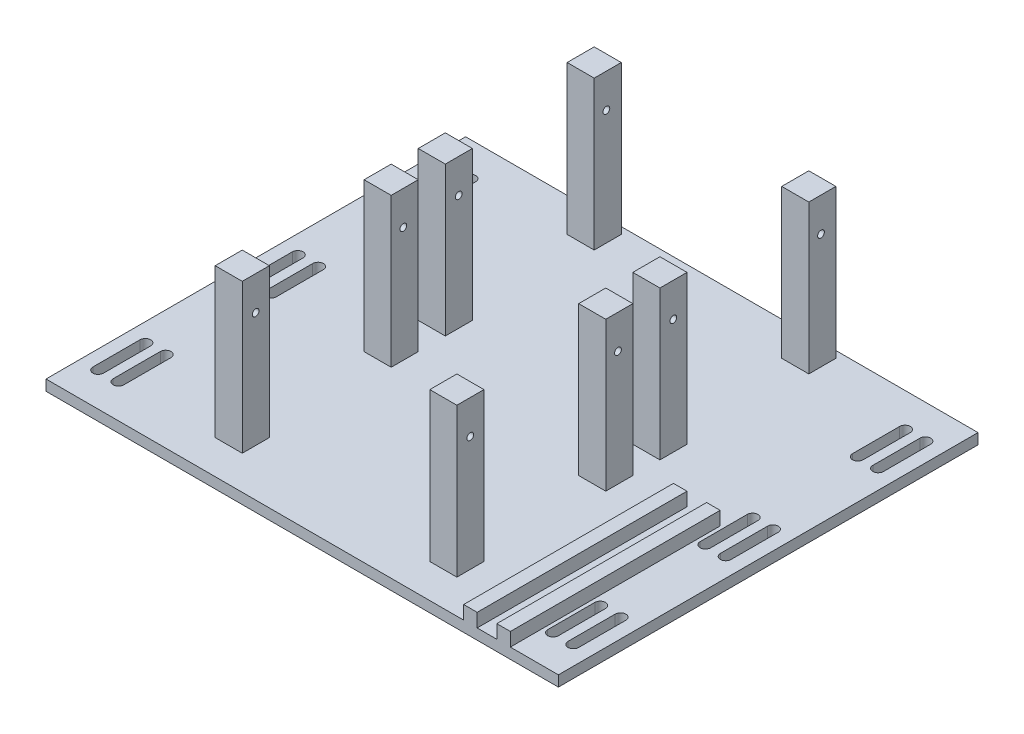
from build123d import *

# Parameters (mm, degrees)
SKETCH1_W                           = 96.1517
SKETCH1_H                           = 78.74
BASE_PLATE_DEPTH                    = 2
SKETCH2_W                           = 5.08
SKETCH2_H                           = 5.08
SERVO_SUPPORTS_DEPTH                = 27.94
SKETCH3_R                           = 0.635
SERVO_MOUNT_HOLES_DEPTH             = 12.7
STRAP_HOLES_REACH                   = 70.132
SERVO_MOUNT_SPACING_COUNT           = 2
SERVO_MOUNT_SPACING_PITCH           = 38.1
SERVO_MOUNT_SPACING_COPY_1_SKETCH_W = 5.08
SERVO_MOUNT_SPACING_COPY_1_SKETCH_H = 5.08
SERVO_MOUNT_SPACING_COPY_1_DEPTH    = 27.94
SERVO_MOUNT_SPACING_COPY_2_SKETCH_R = 0.635
SERVO_MOUNT_SPACING_COPY_2_DEPTH    = 12.7
SKETCH11_W                          = 2.54
SKETCH11_H                          = 39.37
RACK_RAILS_DEPTH                    = 2.54


with BuildPart() as part:
    # Sketch1 → Base Plate (new body)
    with BuildSketch(Plane(origin=(0, 0, 0), x_dir=(1, 0, 0), z_dir=(0, 1, 0))):
        Rectangle(SKETCH1_W, SKETCH1_H)
    extrude(amount=BASE_PLATE_DEPTH)

    # Sketch2 → Servo Supports (add)
    with BuildSketch(Plane(origin=(0, 2, 0), x_dir=(1, 0, 0), z_dir=(0, 1, 0))):
        with Locations((20.13585, -30.48)):
            Rectangle(SKETCH2_W, SKETCH2_H)
        with Locations((20.13585, -2.54)):
            Rectangle(SKETCH2_W, SKETCH2_H)
    servo_supports = extrude(amount=SERVO_SUPPORTS_DEPTH)

    # Sketch3 → Servo Mount Holes (cut)
    with BuildSketch(Plane(origin=(22.67585, 0, 0), x_dir=(0, 0, -1), z_dir=(1, 0, 0))):
        with Locations((-30.504257117, 23.59)):
            Circle(SKETCH3_R)
        with Locations((-2.792857117, 23.59)):
            Circle(SKETCH3_R)
    servo_mount_holes = extrude(amount=-SERVO_MOUNT_HOLES_DEPTH, mode=Mode.SUBTRACT)

    # Sketch4 → Strap Holes (cut, up to next)
    with BuildSketch(Plane(origin=(0, 2, 0), x_dir=(1, 0, 0), z_dir=(0, 1, 0)), mode=Mode.PRIVATE) as strap_holes_sk1:
        with BuildLine():
            Line((45.53585, -24.17), (45.53585, -33.02))
            ThreePointArc((45.53585, -33.02), (44.53585, -34.02), (43.53585, -33.02))
            Line((43.53585, -33.02), (43.53585, -24.17))
            ThreePointArc((43.53585, -24.17), (44.53585, -23.17), (45.53585, -24.17))
        make_face()
    strap_holes_tool1 = extrude(strap_holes_sk1.sketch, amount=-STRAP_HOLES_REACH, mode=Mode.PRIVATE) & part.part
    # Sketch4 → Strap Holes (cut, up to next)
    with BuildSketch(Plane(origin=(0, 2, 0), x_dir=(1, 0, 0), z_dir=(0, 1, 0)), mode=Mode.PRIVATE) as strap_holes_sk2:
        with BuildLine():
            Line((45.53585, 33.02), (45.53585, 24.17))
            ThreePointArc((45.53585, 24.17), (44.53585, 23.17), (43.53585, 24.17))
            Line((43.53585, 24.17), (43.53585, 33.02))
            ThreePointArc((43.53585, 33.02), (44.53585, 34.02), (45.53585, 33.02))
        make_face()
    strap_holes_tool2 = extrude(strap_holes_sk2.sketch, amount=-STRAP_HOLES_REACH, mode=Mode.PRIVATE) & part.part
    # Sketch4 → Strap Holes (cut, up to next)
    with BuildSketch(Plane(origin=(0, 2, 0), x_dir=(1, 0, 0), z_dir=(0, 1, 0)), mode=Mode.PRIVATE) as strap_holes_sk3:
        with BuildLine():
            Line((-43.63085, -24.17), (-43.63085, -33.02))
            ThreePointArc((-43.63085, -33.02), (-44.63085, -34.02), (-45.63085, -33.02))
            Line((-45.63085, -33.02), (-45.63085, -24.17))
            ThreePointArc((-45.63085, -24.17), (-44.63085, -23.17), (-43.63085, -24.17))
        make_face()
    strap_holes_tool3 = extrude(strap_holes_sk3.sketch, amount=-STRAP_HOLES_REACH, mode=Mode.PRIVATE) & part.part
    # Sketch4 → Strap Holes (cut, up to next)
    with BuildSketch(Plane(origin=(0, 2, 0), x_dir=(1, 0, 0), z_dir=(0, 1, 0)), mode=Mode.PRIVATE) as strap_holes_sk4:
        with BuildLine():
            Line((-43.63085, 33.02), (-43.63085, 24.17))
            ThreePointArc((-43.63085, 24.17), (-44.63085, 23.17), (-45.63085, 24.17))
            Line((-45.63085, 24.17), (-45.63085, 33.02))
            ThreePointArc((-45.63085, 33.02), (-44.63085, 34.02), (-43.63085, 33.02))
        make_face()
    strap_holes_tool4 = extrude(strap_holes_sk4.sketch, amount=-STRAP_HOLES_REACH, mode=Mode.PRIVATE) & part.part
    # Sketch4 → Strap Holes (cut, up to next)
    with BuildSketch(Plane(origin=(0, 2, 0), x_dir=(1, 0, 0), z_dir=(0, 1, 0)), mode=Mode.PRIVATE) as strap_holes_sk5:
        with BuildLine():
            Line((45.53585, 4.425), (45.53585, -4.425))
            ThreePointArc((45.53585, -4.425), (44.53585, -5.425), (43.53585, -4.425))
            Line((43.53585, -4.425), (43.53585, 4.425))
            ThreePointArc((43.53585, 4.425), (44.53585, 5.425), (45.53585, 4.425))
        make_face()
    strap_holes_tool5 = extrude(strap_holes_sk5.sketch, amount=-STRAP_HOLES_REACH, mode=Mode.PRIVATE) & part.part
    # Sketch4 → Strap Holes (cut, up to next)
    with BuildSketch(Plane(origin=(0, 2, 0), x_dir=(1, 0, 0), z_dir=(0, 1, 0)), mode=Mode.PRIVATE) as strap_holes_sk6:
        with BuildLine():
            Line((-43.63085, 4.425), (-43.63085, -4.425))
            ThreePointArc((-43.63085, -4.425), (-44.63085, -5.425), (-45.63085, -4.425))
            Line((-45.63085, -4.425), (-45.63085, 4.425))
            ThreePointArc((-45.63085, 4.425), (-44.63085, 5.425), (-43.63085, 4.425))
        make_face()
    strap_holes_tool6 = extrude(strap_holes_sk6.sketch, amount=-STRAP_HOLES_REACH, mode=Mode.PRIVATE) & part.part
    # Sketch4 → Strap Holes (cut, up to next)
    with BuildSketch(Plane(origin=(0, 2, 0), x_dir=(1, 0, 0), z_dir=(0, 1, 0)), mode=Mode.PRIVATE) as strap_holes_sk7:
        with BuildLine():
            Line((41.72585, -24.17), (41.72585, -33.02))
            ThreePointArc((41.72585, -33.02), (40.72585, -34.02), (39.72585, -33.02))
            Line((39.72585, -33.02), (39.72585, -24.17))
            ThreePointArc((39.72585, -24.17), (40.72585, -23.17), (41.72585, -24.17))
        make_face()
    strap_holes_tool7 = extrude(strap_holes_sk7.sketch, amount=-STRAP_HOLES_REACH, mode=Mode.PRIVATE) & part.part
    # Sketch4 → Strap Holes (cut, up to next)
    with BuildSketch(Plane(origin=(0, 2, 0), x_dir=(1, 0, 0), z_dir=(0, 1, 0)), mode=Mode.PRIVATE) as strap_holes_sk8:
        with BuildLine():
            Line((41.72585, 33.02), (41.72585, 24.17))
            ThreePointArc((41.72585, 24.17), (40.72585, 23.17), (39.72585, 24.17))
            Line((39.72585, 24.17), (39.72585, 33.02))
            ThreePointArc((39.72585, 33.02), (40.72585, 34.02), (41.72585, 33.02))
        make_face()
    strap_holes_tool8 = extrude(strap_holes_sk8.sketch, amount=-STRAP_HOLES_REACH, mode=Mode.PRIVATE) & part.part
    # Sketch4 → Strap Holes (cut, up to next)
    with BuildSketch(Plane(origin=(0, 2, 0), x_dir=(1, 0, 0), z_dir=(0, 1, 0)), mode=Mode.PRIVATE) as strap_holes_sk9:
        with BuildLine():
            Line((41.72585, 4.425), (41.72585, -4.425))
            ThreePointArc((41.72585, -4.425), (40.72585, -5.425), (39.72585, -4.425))
            Line((39.72585, -4.425), (39.72585, 4.425))
            ThreePointArc((39.72585, 4.425), (40.72585, 5.425), (41.72585, 4.425))
        make_face()
    strap_holes_tool9 = extrude(strap_holes_sk9.sketch, amount=-STRAP_HOLES_REACH, mode=Mode.PRIVATE) & part.part
    # Sketch4 → Strap Holes (cut, up to next)
    with BuildSketch(Plane(origin=(0, 2, 0), x_dir=(1, 0, 0), z_dir=(0, 1, 0)), mode=Mode.PRIVATE) as strap_holes_sk10:
        with BuildLine():
            Line((-39.82085, -24.17), (-39.82085, -33.02))
            ThreePointArc((-39.82085, -33.02), (-40.82085, -34.02), (-41.82085, -33.02))
            Line((-41.82085, -33.02), (-41.82085, -24.17))
            ThreePointArc((-41.82085, -24.17), (-40.82085, -23.17), (-39.82085, -24.17))
        make_face()
    strap_holes_tool10 = extrude(strap_holes_sk10.sketch, amount=-STRAP_HOLES_REACH, mode=Mode.PRIVATE) & part.part
    # Sketch4 → Strap Holes (cut, up to next)
    with BuildSketch(Plane(origin=(0, 2, 0), x_dir=(1, 0, 0), z_dir=(0, 1, 0)), mode=Mode.PRIVATE) as strap_holes_sk11:
        with BuildLine():
            Line((-39.82085, 33.02), (-39.82085, 24.17))
            ThreePointArc((-39.82085, 24.17), (-40.82085, 23.17), (-41.82085, 24.17))
            Line((-41.82085, 24.17), (-41.82085, 33.02))
            ThreePointArc((-41.82085, 33.02), (-40.82085, 34.02), (-39.82085, 33.02))
        make_face()
    strap_holes_tool11 = extrude(strap_holes_sk11.sketch, amount=-STRAP_HOLES_REACH, mode=Mode.PRIVATE) & part.part
    # Sketch4 → Strap Holes (cut, up to next)
    with BuildSketch(Plane(origin=(0, 2, 0), x_dir=(1, 0, 0), z_dir=(0, 1, 0)), mode=Mode.PRIVATE) as strap_holes_sk12:
        with BuildLine():
            Line((-39.82085, 4.425), (-39.82085, -4.425))
            ThreePointArc((-39.82085, -4.425), (-40.82085, -5.425), (-41.82085, -4.425))
            Line((-41.82085, -4.425), (-41.82085, 4.425))
            ThreePointArc((-41.82085, 4.425), (-40.82085, 5.425), (-39.82085, 4.425))
        make_face()
    strap_holes_tool12 = extrude(strap_holes_sk12.sketch, amount=-STRAP_HOLES_REACH, mode=Mode.PRIVATE) & part.part
    add(strap_holes_tool1.solids().sort_by_distance((44.53585, 2, 28.595))[0], mode=Mode.SUBTRACT)
    add(strap_holes_tool2.solids().sort_by_distance((44.53585, 2, -28.595))[0], mode=Mode.SUBTRACT)
    add(strap_holes_tool3.solids().sort_by_distance((-44.63085, 2, 28.595))[0], mode=Mode.SUBTRACT)
    add(strap_holes_tool4.solids().sort_by_distance((-44.63085, 2, -28.595))[0], mode=Mode.SUBTRACT)
    add(strap_holes_tool5.solids().sort_by_distance((44.53585, 2, 0))[0], mode=Mode.SUBTRACT)
    add(strap_holes_tool6.solids().sort_by_distance((-44.63085, 2, 0))[0], mode=Mode.SUBTRACT)
    add(strap_holes_tool7.solids().sort_by_distance((40.72585, 2, 28.595))[0], mode=Mode.SUBTRACT)
    add(strap_holes_tool8.solids().sort_by_distance((40.72585, 2, -28.595))[0], mode=Mode.SUBTRACT)
    add(strap_holes_tool9.solids().sort_by_distance((40.72585, 2, 0))[0], mode=Mode.SUBTRACT)
    add(strap_holes_tool10.solids().sort_by_distance((-40.82085, 2, 28.595))[0], mode=Mode.SUBTRACT)
    add(strap_holes_tool11.solids().sort_by_distance((-40.82085, 2, -28.595))[0], mode=Mode.SUBTRACT)
    add(strap_holes_tool12.solids().sort_by_distance((-40.82085, 2, 0))[0], mode=Mode.SUBTRACT)

    # Servo Mount Mirror: Servo Supports, Servo Mount Holes across plane
    add(servo_supports.mirror(Plane(origin=(0, 0, 0), x_dir=(0, 0, 1), z_dir=(1, 0, 0))))
    add(servo_mount_holes.mirror(Plane(origin=(0, 0, 0), x_dir=(0, 0, 1), z_dir=(1, 0, 0))), mode=Mode.SUBTRACT)

    # Servo Mount Spacing: Servo Supports, Servo Mount Holes ×2
    with Locations(*[(0, 0, -i * SERVO_MOUNT_SPACING_PITCH) for i in range(1, SERVO_MOUNT_SPACING_COUNT)]):
        add(servo_supports)
        add(servo_mount_holes, mode=Mode.SUBTRACT)

    # Servo Mount Spacing copy 1 sketch → Servo Mount Spacing copy 1 (add)
    with BuildSketch(Plane(origin=(0, 2, -38.1), x_dir=(-1, 0, 0), z_dir=(0, 1, 0))):
        with Locations((20.13585, 30.48)):
            Rectangle(SERVO_MOUNT_SPACING_COPY_1_SKETCH_W, SERVO_MOUNT_SPACING_COPY_1_SKETCH_H)
        with Locations((20.13585, 2.54)):
            Rectangle(SERVO_MOUNT_SPACING_COPY_1_SKETCH_W, SERVO_MOUNT_SPACING_COPY_1_SKETCH_H)
    extrude(amount=SERVO_MOUNT_SPACING_COPY_1_DEPTH)

    # Servo Mount Spacing copy 2 sketch → Servo Mount Spacing copy 2 (cut)
    with BuildSketch(Plane(origin=(-22.67585, 0, -38.1), x_dir=(0, 0, -1), z_dir=(-1, 0, 0))):
        with Locations((-30.504257117, -23.59)):
            Circle(SERVO_MOUNT_SPACING_COPY_2_SKETCH_R)
        with Locations((-2.792857117, -23.59)):
            Circle(SERVO_MOUNT_SPACING_COPY_2_SKETCH_R)
    extrude(amount=-SERVO_MOUNT_SPACING_COPY_2_DEPTH, mode=Mode.SUBTRACT)

    # Sketch11 → Rack Rails (add)
    with BuildSketch(Plane(origin=(0, 2, 0), x_dir=(1, 0, 0), z_dir=(0, 1, 0))):
        with Locations((31.56585, -19.685)):
            Rectangle(SKETCH11_W, SKETCH11_H)
        with Locations((37.78885, -19.685)):
            Rectangle(SKETCH11_W, SKETCH11_H)
    extrude(amount=RACK_RAILS_DEPTH)


solid = part.part
